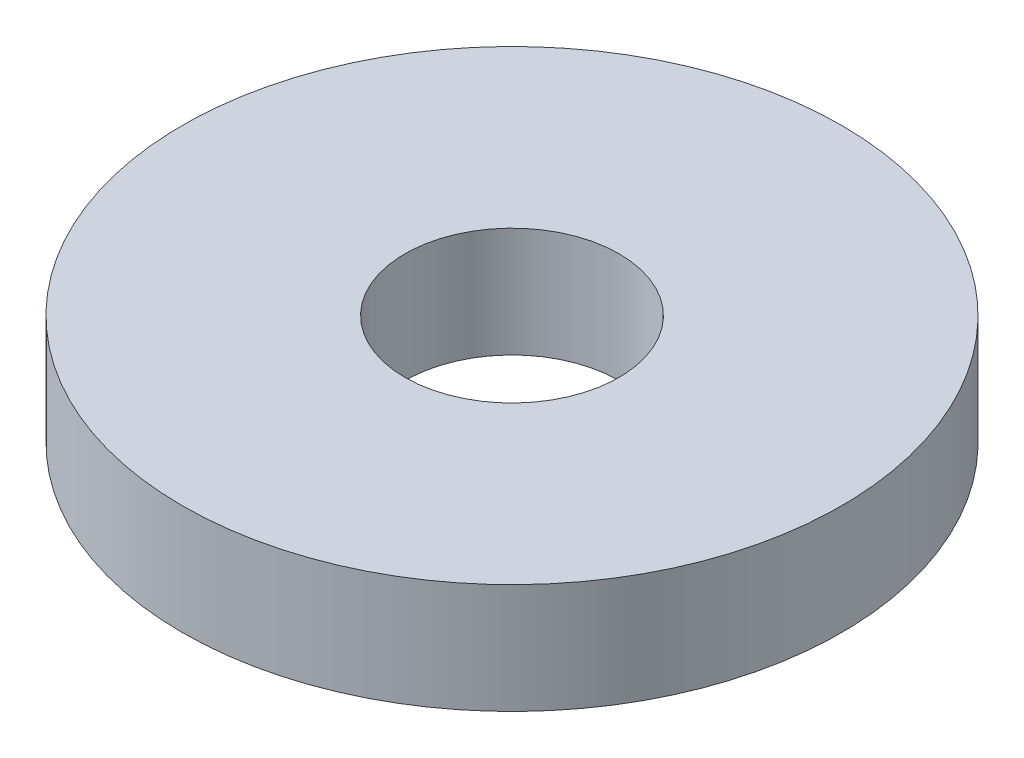
from build123d import *

# Parameters (mm, degrees)
ESBO_O1_R                = 6
ESBO_O1_R_2              = 1.95
RESSALTO_EXTRUS_O1_DEPTH = 2


with BuildPart() as part:
    # Esboço1 → Ressalto-extrusão1 (new body)
    with BuildSketch(Plane(origin=(0, 0, 0), x_dir=(1, 0, 0), z_dir=(0, 1, 0))):
        with Locations(Location((0, 0, 0), (0, 0, 270))):
            Circle(ESBO_O1_R)
        with Locations(Location((0, 0, 0), (0, 0, 270))):
            Circle(ESBO_O1_R_2, mode=Mode.SUBTRACT)
    extrude(amount=RESSALTO_EXTRUS_O1_DEPTH)


solid = part.part
